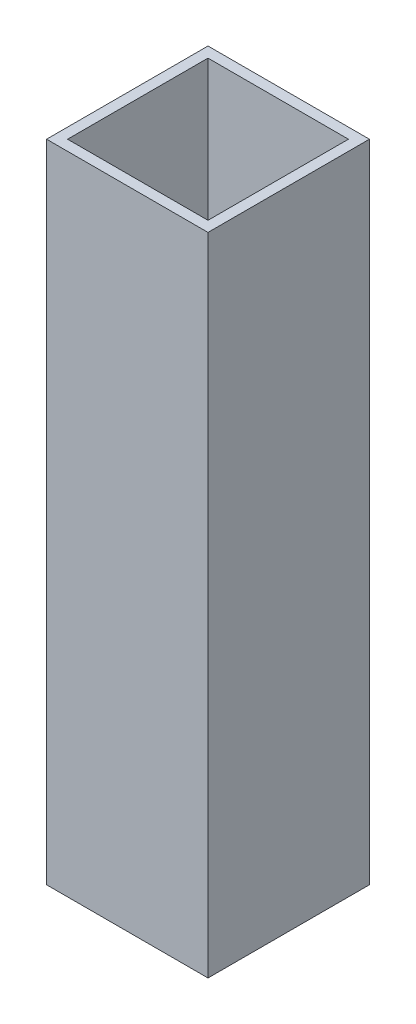
from build123d import *

# Parameters (mm, degrees)
SKETCH1_W           = 25.4
SKETCH1_H           = 25.4
BOSS_EXTRUDE1_DEPTH = 101.6
SKETCH2_W           = 22.098
SKETCH2_H           = 22.098
CUT_EXTRUDE1_DEPTH  = 101.6


with BuildPart() as part:
    # Sketch1 → Boss-Extrude1 (new body)
    with BuildSketch(Plane(origin=(0, 0, 0), x_dir=(1, 0, 0), z_dir=(0, 1, 0))):
        with Locations((12.7, -12.7)):
            Rectangle(SKETCH1_W, SKETCH1_H)
    extrude(amount=BOSS_EXTRUDE1_DEPTH)

    # Sketch2 → Cut-Extrude1 (cut)
    with BuildSketch(Plane(origin=(0, 101.6, 0), x_dir=(1, 0, 0), z_dir=(0, 1, 0))):
        with Locations((12.7, -12.7)):
            Rectangle(SKETCH2_W, SKETCH2_H)
    extrude(amount=-CUT_EXTRUDE1_DEPTH, mode=Mode.SUBTRACT)


solid = part.part
